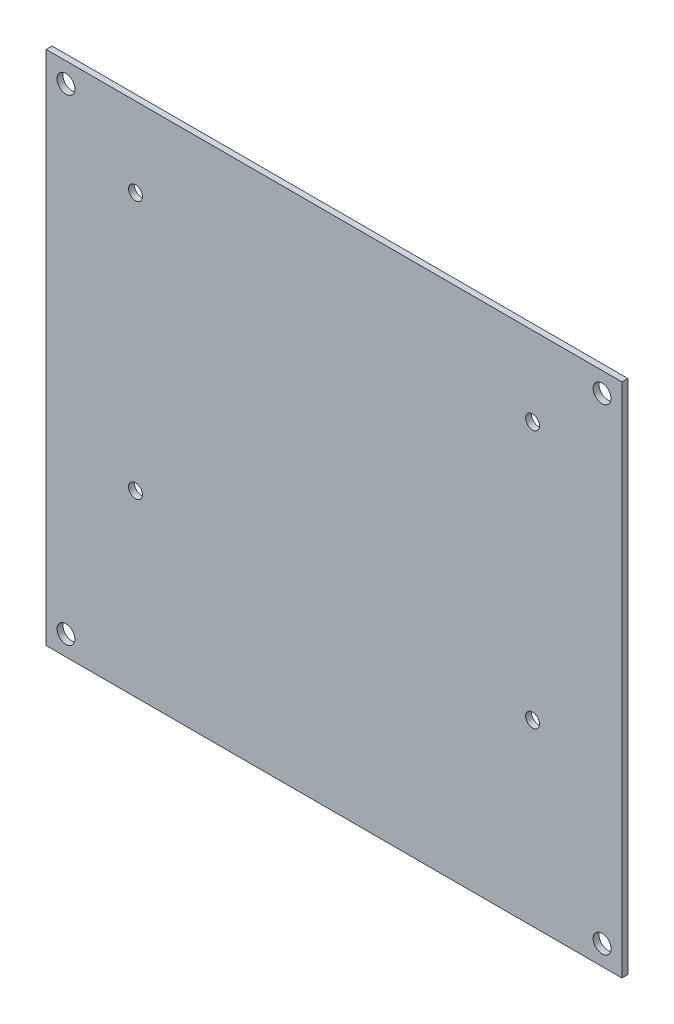
from build123d import *

# Parameters (mm, degrees)
SKETCH_1_W      = 145
SKETCH_1_H      = 130
SKETCH_1_R      = 2.25
SKETCH_1_R_2    = 1.75
EXTRUDE_1_DEPTH = 1.5


with BuildPart() as part:
    # Эскиз1 → Вытянуть1 (new body)
    with BuildSketch(Plane.XY):
        Rectangle(SKETCH_1_W, SKETCH_1_H)
        with Locations((-67.5, 60)):
            Circle(SKETCH_1_R, mode=Mode.SUBTRACT)
        with Locations(Location((-67.5, -60, 0), (0, 0, 180))):
            Circle(SKETCH_1_R, mode=Mode.SUBTRACT)
        with Locations((67.5, -60)):
            Circle(SKETCH_1_R, mode=Mode.SUBTRACT)
        with Locations(Location((67.5, 60, 0), (0, 0, 180))):
            Circle(SKETCH_1_R, mode=Mode.SUBTRACT)
        with Locations((-50, 45)):
            Circle(SKETCH_1_R_2, mode=Mode.SUBTRACT)
        with Locations(Location((-50, -20, 0), (0, 0, 180))):
            Circle(SKETCH_1_R_2, mode=Mode.SUBTRACT)
        with Locations((50, 45)):
            Circle(SKETCH_1_R_2, mode=Mode.SUBTRACT)
        with Locations(Location((50, -20, 0), (0, 0, 180))):
            Circle(SKETCH_1_R_2, mode=Mode.SUBTRACT)
    extrude(amount=EXTRUDE_1_DEPTH)


solid = part.part
